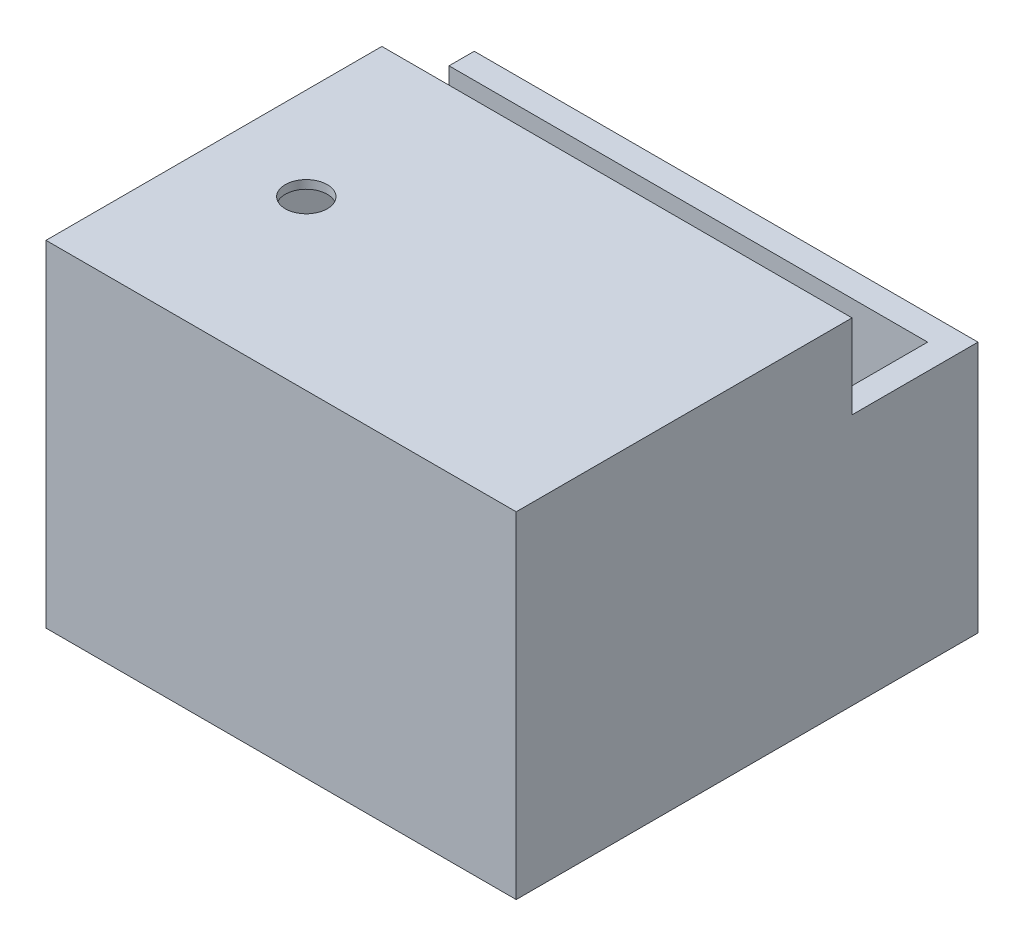
from build123d import *

# Parameters (mm, degrees)
EXTRUDE_THIN1_DEPTH = 30
SKETCH2_R           = 4.1
CUT_EXTRUDE1_DEPTH  = 10
BOSS_EXTRUDE1_START = -3
SKETCH3_W           = 40
SKETCH3_H           = 40
BOSS_EXTRUDE1_DEPTH = 15
SKETCH4_R           = 6
BOSS_EXTRUDE2_DEPTH = 5
FILLET1_R           = 2
SKETCH5_W           = 40
SKETCH5_H           = 40
SKETCH5_W_2         = 38
SKETCH5_H_2         = 38
BOSS_EXTRUDE3_DEPTH = 40
SKETCH6_W           = 40
SKETCH6_H           = 40
BOSS_EXTRUDE4_DEPTH = 1
SKETCH7_R           = 2.5
CUT_EXTRUDE2_DEPTH  = 91.691785736


with BuildPart() as part:
    # Sketch1 → Extrude-Thin1 (new body)
    with BuildSketch(Plane(origin=(0, 0, 0), x_dir=(1, 0, 0), z_dir=(0, 1, 0))):
        Polygon((0, 0), (60, 0), (60, -15), (57, -15), (57, -3), (0, -3), align=None)
    extrude(amount=EXTRUDE_THIN1_DEPTH)

    # Sketch2 → Cut-Extrude1 (cut)
    with BuildSketch(Plane.XY.offset(3)):
        with Locations((15, 15)):
            Circle(SKETCH2_R)
    extrude(amount=-CUT_EXTRUDE1_DEPTH, mode=Mode.SUBTRACT)

    # Sketch3 → Boss-Extrude1 (add)
    with BuildSketch(Plane.ZY.offset(-57).offset(BOSS_EXTRUDE1_START)):
        with Locations((35, 20)):
            Rectangle(SKETCH3_W, SKETCH3_H)
    extrude(amount=BOSS_EXTRUDE1_DEPTH)

    # Sketch4 → Boss-Extrude2 (add)
    with BuildSketch(Plane.ZY.offset(-45)):
        with Locations(Location((35, 20, 0), (0, 0, 180))):
            Circle(SKETCH4_R)
    extrude(amount=BOSS_EXTRUDE2_DEPTH)

    # Fillet1
    fillet1_edges = [part.edges().sort_by_distance(p)[0] for p in [
        (45, 20, 41),
    ]]
    fillet(fillet1_edges, radius=FILLET1_R)

    # Sketch5 → Boss-Extrude3 (add)
    with BuildSketch(Plane.ZY.offset(-45)):
        with Locations((35, 20)):
            Rectangle(SKETCH5_W, SKETCH5_H)
        with Locations((35, 20)):
            Rectangle(SKETCH5_W_2, SKETCH5_H_2, mode=Mode.SUBTRACT)
    extrude(amount=BOSS_EXTRUDE3_DEPTH)

    # Sketch6 → Boss-Extrude4 (add)
    with BuildSketch(Plane.ZY.offset(-5)):
        with Locations((35, 20)):
            Rectangle(SKETCH6_W, SKETCH6_H)
    extrude(amount=BOSS_EXTRUDE4_DEPTH)

    # Sketch7 → Cut-Extrude2 (cut, through all)
    with BuildSketch(Plane(origin=(0, 40, 0), x_dir=(1, 0, 0), z_dir=(0, 1, 0))):
        with Locations(Location((15, -35, 0), (0, 0, 270))):
            Circle(SKETCH7_R)
    extrude(amount=-CUT_EXTRUDE2_DEPTH, mode=Mode.SUBTRACT)

    # Sketch8 → Revolve1 (revolve)
    with BuildSketch(Plane.XY.offset(35), mode=Mode.PRIVATE) as revolve1_sk:
        Polygon((17.5, 1), (22.966741001, 8.14945752), (23.966741001, 8.14945752), (23.966741001, 1), align=None)
    revolve(revolve1_sk.sketch.rotate(Axis((15, 1, 35), (0, 1, 0)), 90), axis=Axis((15, 1, 35), (0, 1, 0)))


solid = part.part
